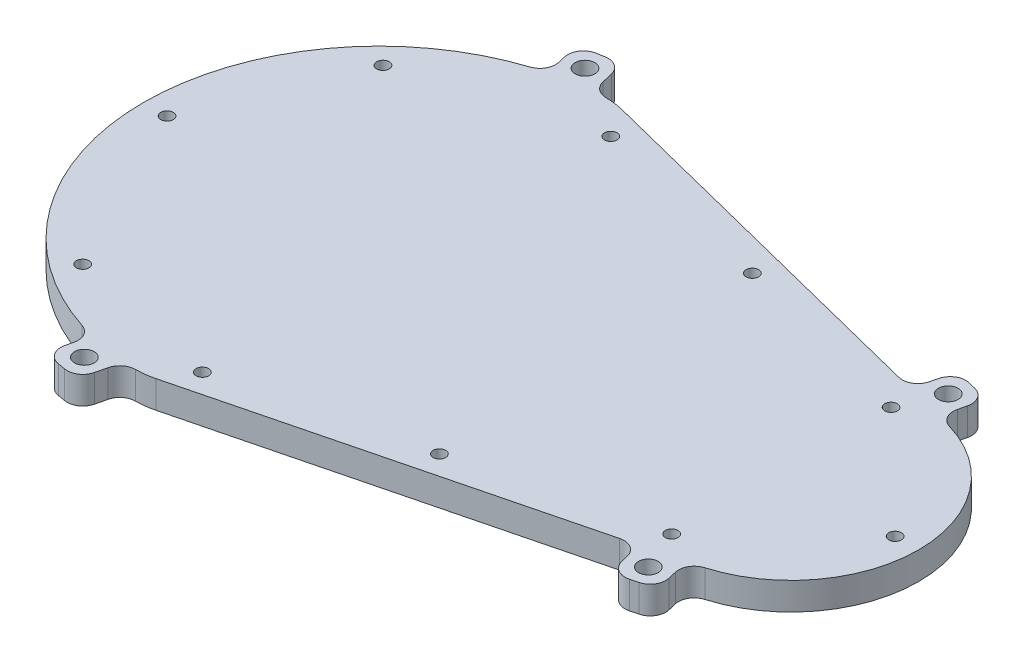
from build123d import *

# Parameters (mm, degrees)
SKETCH1_R           = 1.6
BOSS_EXTRUDE1_DEPTH = 7
BOSS_EXTRUDE2_DEPTH = 7
SKETCH3_R           = 2.5
CUT_EXTRUDE1_DEPTH  = 7
FILLET1_R           = 4
FILLET2_R           = 20
SKETCH5_R           = 20
SKETCH5_R_2         = 3
CUT_EXTRUDE3_DEPTH  = 2


with BuildPart() as part:
    # Sketch1 → Boss-Extrude1 (new body)
    with BuildSketch(Plane(origin=(0, 0, 0), x_dir=(1, 0, 0), z_dir=(0, 1, 0))):
        with BuildLine():
            Line((-40.085587865, -58.991121495), (72.606562154, -30.567708203))
            ThreePointArc((72.606562154, -30.567708203), (97.414412135, 1.008878505), (72.606562154, 32.585465212))
            Line((72.606562154, 32.585465212), (-40.085587865, 61.008878505))
            ThreePointArc((-40.085587865, 61.008878505), (-100.085587865, 1.008878505), (-40.085587865, -58.991121495))
        make_face()
        with Locations(Location((15.176377483, -38.864945804, 0), (0, 0, 270))):
            Circle(SKETCH1_R, mode=Mode.SUBTRACT)
        with Locations(Location((-33.054187001, -51.02974404, 0), (0, 0, 270))):
            Circle(SKETCH1_R, mode=Mode.SUBTRACT)
        with Locations(Location((62.43730848, -26.944710242, 0), (0, 0, 270))):
            Circle(SKETCH1_R, mode=Mode.SUBTRACT)
        with Locations(Location((91.414412135, 1.008878505, 0), (0, 0, 270))):
            Circle(SKETCH1_R, mode=Mode.SUBTRACT)
        with Locations(Location((-33.054187001, 53.047501049, 0), (0, 0, 270))):
            Circle(SKETCH1_R, mode=Mode.SUBTRACT)
        with Locations(Location((15.176377483, 40.882702814, 0), (0, 0, 270))):
            Circle(SKETCH1_R, mode=Mode.SUBTRACT)
        with Locations(Location((62.43730848, 28.962467251, 0), (0, 0, 270))):
            Circle(SKETCH1_R, mode=Mode.SUBTRACT)
        with Locations(Location((-94.085587865, 1.008878505, 0), (0, 0, 270))):
            Circle(SKETCH1_R, mode=Mode.SUBTRACT)
        with Locations(Location((-72.125195915, -42.459081144, 0), (0, 0, 270))):
            Circle(SKETCH1_R, mode=Mode.SUBTRACT)
        with Locations(Location((-77.764180777, 39.691221197, 0), (0, 0, 270))):
            Circle(SKETCH1_R, mode=Mode.SUBTRACT)
    extrude(amount=BOSS_EXTRUDE1_DEPTH)

    # Sketch2 → Boss-Extrude2 (add)
    with BuildSketch(Plane(origin=(0, 7, 0), x_dir=(1, 0, 0), z_dir=(0, 1, 0))):
        Polygon((-55.149276996, 59.087146986), (-45.294016341, 60.782386623), (-47.607258378, 70.511153826), (-57.462519032, 68.815914188), align=None)
        Polygon((60.73773507, 35.579041761), (70.434069941, 33.133415038), (72.769614826, 42.856852192), (63.073279955, 45.302478915), align=None)
        Polygon((63.073279955, -43.284721905), (72.769614826, -40.839095183), (70.434069941, -31.115658029), (60.73773507, -33.561284751), align=None)
        Polygon((-57.462519032, -66.798157179), (-47.607258378, -68.493396816), (-45.294016341, -58.764629614), (-55.149276996, -57.069389977), align=None)
    extrude(amount=-BOSS_EXTRUDE2_DEPTH)

    # Sketch3 → Cut-Extrude1 (cut)
    with BuildSketch(Plane(origin=(0, 7, 0), x_dir=(1, 0, 0), z_dir=(0, 1, 0))):
        with Locations(Location((-51.385785587, 64.787762931, 0), (0, 0, 270))):
            Circle(SKETCH3_R)
        with Locations(Location((66.753288323, 39.217713116, 0), (0, 0, 270))):
            Circle(SKETCH3_R)
        with Locations(Location((66.753288323, -37.199956106, 0), (0, 0, 90))):
            Circle(SKETCH3_R)
        with Locations(Location((-51.385785587, -62.770005922, 0), (0, 0, 90))):
            Circle(SKETCH3_R)
    extrude(amount=-CUT_EXTRUDE1_DEPTH, mode=Mode.SUBTRACT)

    # Fillet1
    fillet1_edges = [part.edges().sort_by_distance(p)[0] for p in [
        (-55.149276996, 3.5, 57.069389977),
        (-57.462519032, 3.5, 66.798157179),
        (-47.607258378, 3.5, 68.493396816),
        (-45.294016341, 3.5, 58.764629614),
        (70.434069941, 3.5, 31.115658029),
        (72.769614826, 3.5, 40.839095183),
        (63.073279955, 3.5, 43.284721905),
        (60.73773507, 3.5, 33.561284751),
        (60.73773507, 3.5, -35.579041761),
        (63.073279955, 3.5, -45.302478915),
        (72.769614826, 3.5, -42.856852192),
        (70.434069941, 3.5, -33.133415038),
        (-45.294016341, 3.5, -60.782386623),
        (-55.149276996, 3.5, -59.087146986),
        (-47.607258378, 3.5, -70.511153826),
        (-57.462519032, 3.5, -68.815914188),
    ]]
    fillet(fillet1_edges, radius=FILLET1_R)

    # Fillet2
    fillet2_edges = [part.edges().sort_by_distance(p)[0] for p in [
        (-40.085587865, 3.5, 58.991121495),
        (-40.085587865, 3.5, -61.008878505),
    ]]
    fillet(fillet2_edges, radius=FILLET2_R)

    # Sketch5 → Cut-Extrude3 (cut)
    with BuildSketch(Plane.XZ):
        with Locations(Location((-45.085587865, -1.008878505, 0), (0, 0, 270))):
            Circle(SKETCH5_R)
        with Locations(Location((64.914412135, -1.008878505, 0), (0, 0, 270))):
            Circle(SKETCH5_R_2)
    extrude(amount=-CUT_EXTRUDE3_DEPTH, mode=Mode.SUBTRACT)


solid = part.part
